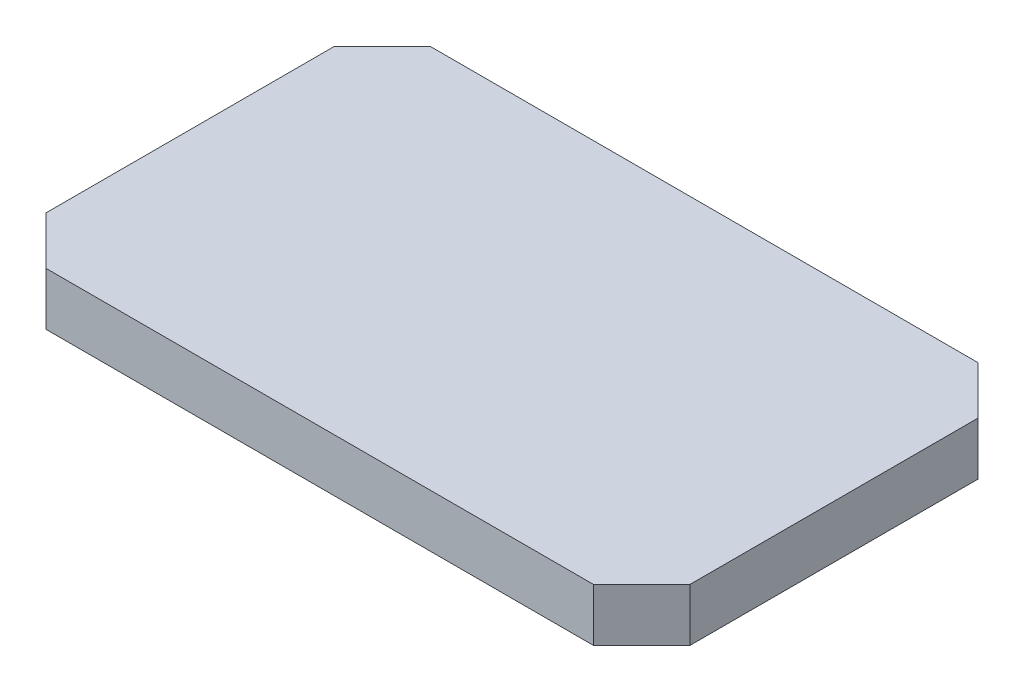
from build123d import *

# Parameters (mm, degrees)
SKETCH2_W      = 67
SKETCH2_H      = 40
EXTRUDE1_DEPTH = 5.5
CHAMFER1_SIZE  = 5


with BuildPart() as part:
    # Sketch2 → Extrude1 (new body)
    with BuildSketch(Plane(origin=(0, 0, 0), x_dir=(1, 0, 0), z_dir=(0, 1, 0))):
        Rectangle(SKETCH2_W, SKETCH2_H)
    extrude(amount=EXTRUDE1_DEPTH)

    # Chamfer1
    chamfer1_edges = [part.edges().sort_by_distance(p)[0] for p in [
        (33.5, 2.75, 20),
        (-33.5, 2.75, 20),
        (-33.5, 2.75, -20),
        (33.5, 2.75, -20),
    ]]
    chamfer(chamfer1_edges, length=CHAMFER1_SIZE)


solid = part.part
